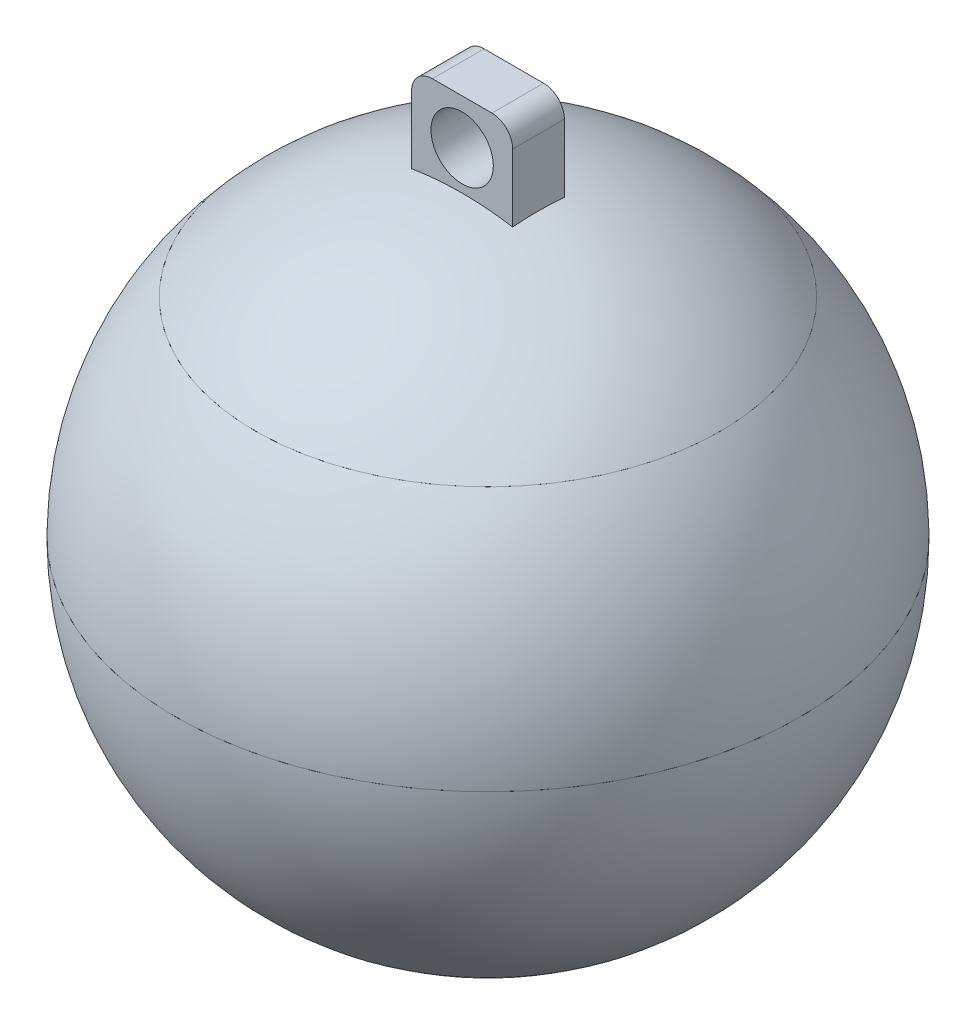
from build123d import *

# Parameters (mm, degrees)
BOSS_EXTRUDE1_START = 19
SKETCH5_W           = 4.861205616
SKETCH5_H           = 2.487128454
BOSS_EXTRUDE1_DEPTH = 5
FILLET1_R           = 1
SKETCH6_R           = 1.5
CUT_EXTRUDE1_DEPTH  = 5


with BuildPart() as part:
    # Sketch1 → Revolve1 (revolve)
    with BuildSketch(Plane.XY):
        with BuildLine():
            Line((0, 0), (0, -15))
            ThreePointArc((0, -15), (-10.606601718, -10.606601718), (-15, 0))
            Line((-15, 0), (0, 0))
        make_face()
    revolve(axis=Axis((0, 0, 0), (0, -1, 0)))


with BuildPart() as body_2:
    # Sketch3 → Revolve3 (revolve)
    with BuildSketch(Plane.XY, mode=Mode.PRIVATE) as revolve3_sk:
        with BuildLine():
            Line((-15, 0), (0, 0))
            Line((0, 0), (0, 10))
            Line((0, 10), (-11.180339887, 10))
            ThreePointArc((-11.180339887, 10), (-14.012585384, 5.352331347), (-15, 0))
        make_face()
    revolve(revolve3_sk.sketch.rotate(Axis((0, 0, 0), (0, 1, 0)), 270), axis=Axis((0, 0, 0), (0, 1, 0)))


with BuildPart() as body_3:
    # Sketch4 → Revolve4 (revolve)
    with BuildSketch(Plane.XY):
        with BuildLine():
            Line((0, 10), (0, 15))
            ThreePointArc((0, 15), (-6.123724357, 13.693063938), (-11.180339887, 10))
            Line((-11.180339887, 10), (0, 10))
        make_face()
    revolve(axis=Axis((0, 10, 0), (0, 1, 0)))

    # Sketch5 → Boss-Extrude1 (add)
    with BuildSketch(Plane(origin=(0, 0, 0), x_dir=(1, 0, 0), z_dir=(0, 1, 0)).offset(BOSS_EXTRUDE1_START)):
        Rectangle(SKETCH5_W, SKETCH5_H)
    extrude(amount=-BOSS_EXTRUDE1_DEPTH)

    # Fillet1
    fillet1_edges = [body_3.edges().sort_by_distance(p)[0] for p in [
        (2.430602808, 19, 0),
        (-2.430602808, 19, 0),
    ]]
    fillet(fillet1_edges, radius=FILLET1_R)

    # Sketch6 → Cut-Extrude1 (cut)
    with BuildSketch(Plane.XY.offset(1.243564227)):
        with Locations((0, 16.8335136)):
            Circle(SKETCH6_R)
    extrude(amount=-CUT_EXTRUDE1_DEPTH, mode=Mode.SUBTRACT)


solid = Compound([part.part, body_2.part, body_3.part])
